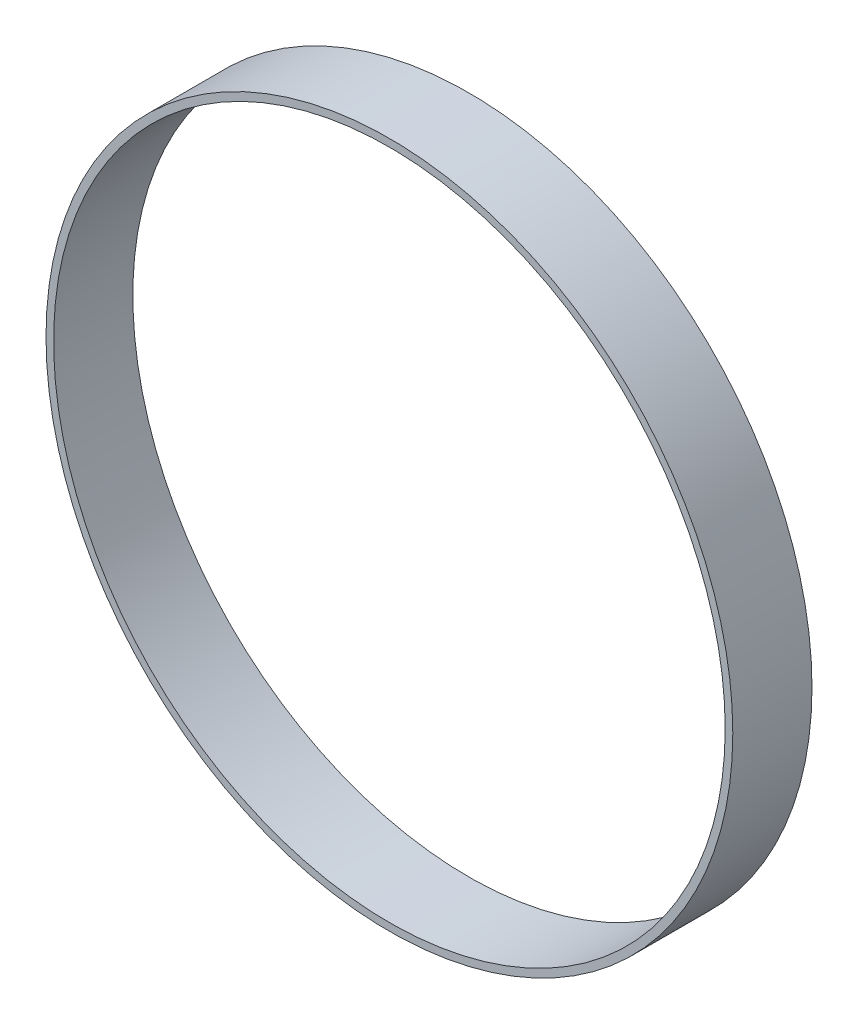
from build123d import *

# Parameters (mm, degrees)
SZKIC1_R                    = 54.2
SZKIC1_R_2                  = 53
DODANIE_WYCI_GNI_CIE1_DEPTH = 12.5


with BuildPart() as part:
    # Szkic1 → Dodanie-wyciągnięcie1 (new body)
    with BuildSketch(Plane.XY):
        with Locations((49.292524281, 35.345669959)):
            Circle(SZKIC1_R)
        with Locations((49.292524281, 35.345669959)):
            Circle(SZKIC1_R_2, mode=Mode.SUBTRACT)
    extrude(amount=-DODANIE_WYCI_GNI_CIE1_DEPTH)


solid = part.part
